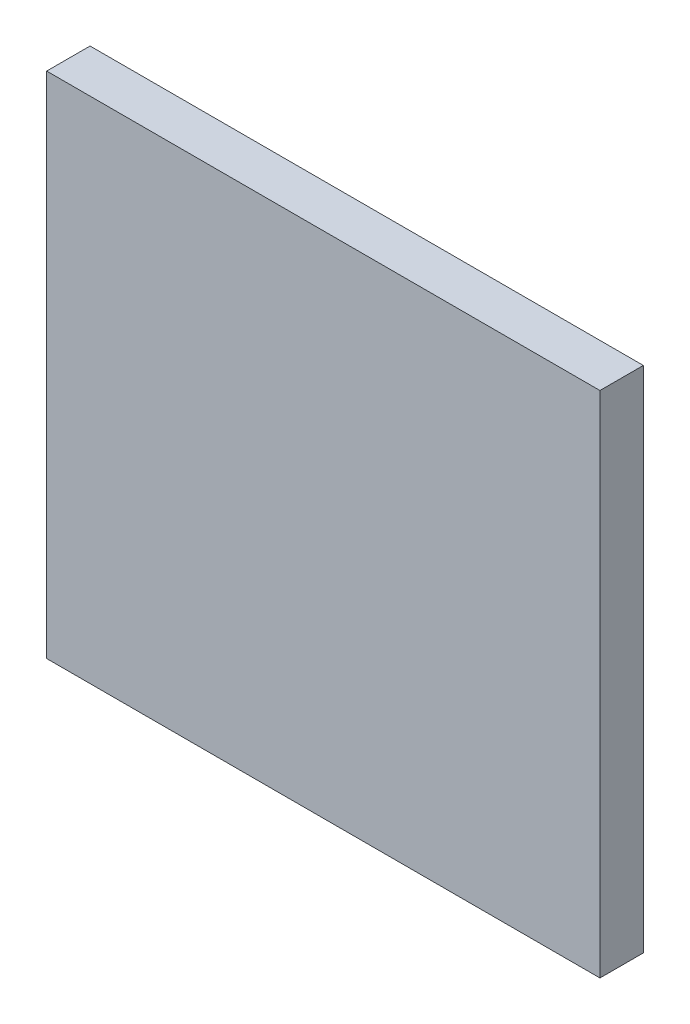
from build123d import *

# Parameters (mm, degrees)
SKETCH_1_W      = 25.5
SKETCH_1_H      = 23.45
EXTRUDE_1_DEPTH = 2


with BuildPart() as part:
    # Эскиз1 → Бобышка-Вытянуть1 (new body)
    with BuildSketch(Plane.XY):
        with Locations((170.078437888, -94.735487871)):
            Rectangle(SKETCH_1_W, SKETCH_1_H)
    extrude(amount=EXTRUDE_1_DEPTH)


solid = part.part
